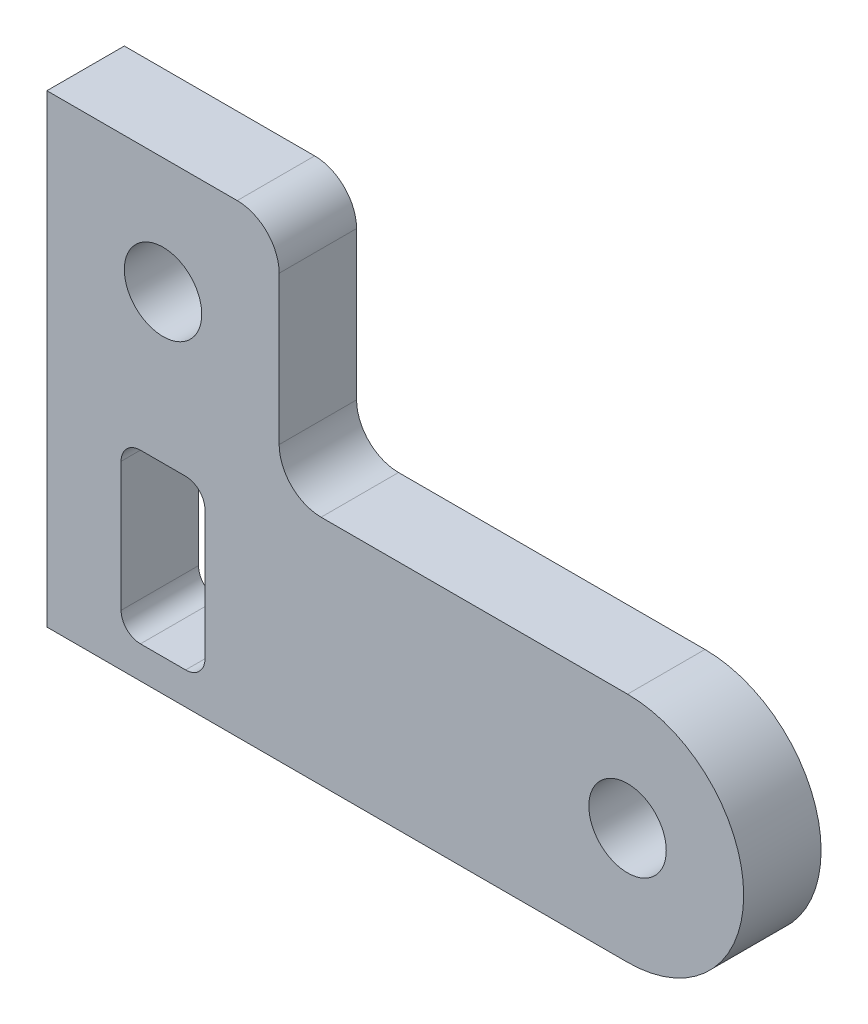
from build123d import *

# Parameters (mm, degrees)
MODEL_R                 = 1.5
SALIENTE_EXTRUIR1_DEPTH = 3


with BuildPart() as part:
    # Model → Saliente-Extruir1 (new body)
    with BuildSketch(Plane.XY):
        with BuildLine():
            Line((185.972853309, 282.646547335), (178.597853309, 282.646547335))
            Line((178.597853309, 282.646547335), (178.597853309, 264.646547335))
            Line((178.597853309, 264.646547335), (201.097853309, 264.646547335))
            ThreePointArc((201.097853309, 264.646547335), (205.597853309, 269.146547335), (201.097853309, 273.646547335))
            Line((201.097853309, 273.646547335), (189.222853309, 273.646547335))
            ThreePointArc((189.222853309, 273.646547335), (188.07380479, 274.122498816), (187.597853309, 275.271547335))
            Line((187.597853309, 275.271547335), (187.597853309, 281.021547335))
            ThreePointArc((187.597853309, 281.021547335), (187.121901829, 282.170595855), (185.972853309, 282.646547335))
        make_face()
        with Locations((201.097853309, 269.146547335)):
            Circle(MODEL_R, mode=Mode.SUBTRACT)
        with Locations((183.097853309, 278.145968764)):
            Circle(MODEL_R, mode=Mode.SUBTRACT)
        with BuildLine():
            Line((182.222853309, 265.896547335), (183.972853309, 265.896547335))
            ThreePointArc((183.972853309, 265.896547335), (184.503183395, 266.116217249), (184.722853309, 266.646547335))
            Line((184.722853309, 266.646547335), (184.722853309, 271.646547335))
            ThreePointArc((184.722853309, 271.646547335), (184.503183395, 272.176877421), (183.972853309, 272.396547335))
            Line((183.972853309, 272.396547335), (182.222853309, 272.396547335))
            ThreePointArc((182.222853309, 272.396547335), (181.692523223, 272.176877421), (181.472853309, 271.646547335))
            Line((181.472853309, 271.646547335), (181.472853309, 266.646547335))
            ThreePointArc((181.472853309, 266.646547335), (181.692523223, 266.116217249), (182.222853309, 265.896547335))
        make_face(mode=Mode.SUBTRACT)
    extrude(amount=SALIENTE_EXTRUIR1_DEPTH)


solid = part.part
